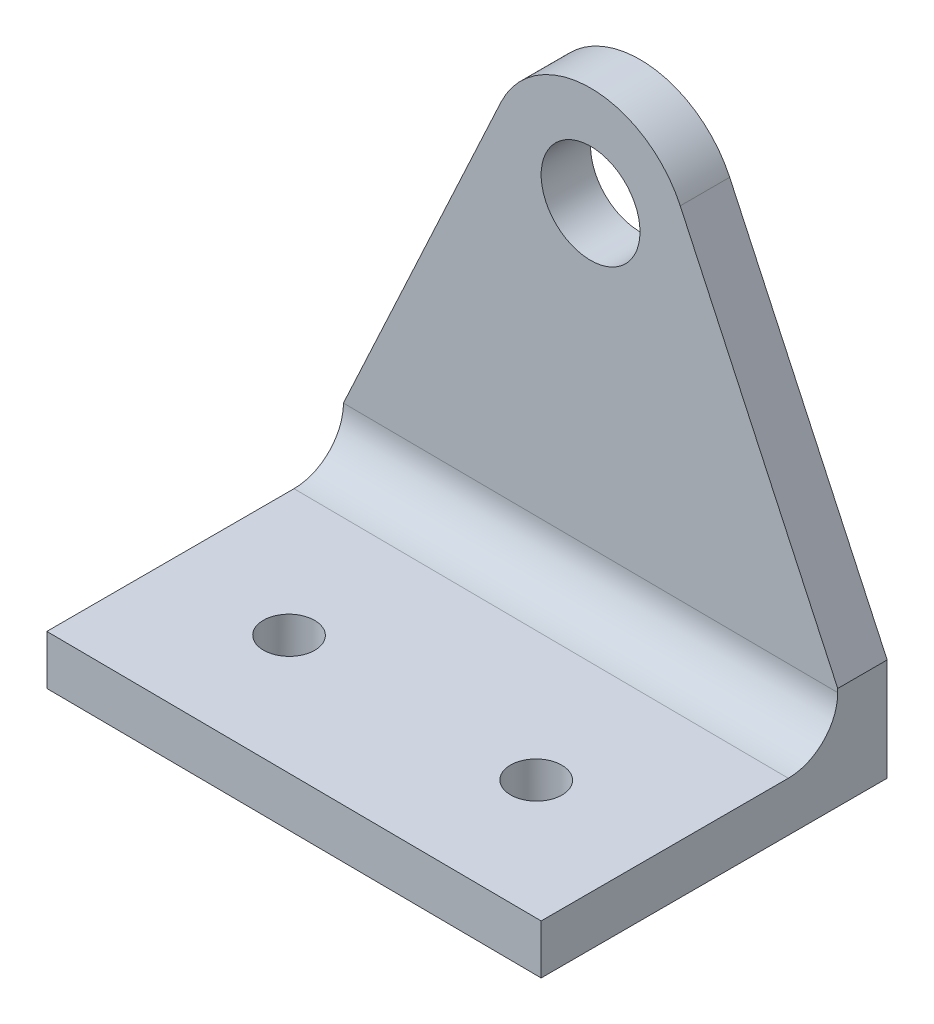
from build123d import *

# Parameters (mm, degrees)
SKETCH1_R           = 5
BOSS_EXTRUDE1_DEPTH = 5
BOSS_EXTRUDE2_DEPTH = 30
FILLET1_R           = 5
SKETCH7_R           = 2.6
CUT_EXTRUDE1_DEPTH  = 30


with BuildPart() as part:
    # Sketch1 → Boss-Extrude1 (new body)
    with BuildSketch(Plane.XY):
        with BuildLine():
            Line((-9.070221734, 4.313108884), (-25, -30))
            Line((-25, -30), (-25, -40))
            Line((-25, -40), (25, -40.363582182))
            Line((25, -40.363582182), (25, -30))
            Line((25, -30), (9.070221734, 4.313108884))
            ThreePointArc((9.070221734, 4.313108884), (0, 10.102280261), (-9.070221734, 4.313108884))
        make_face()
        Circle(SKETCH1_R, mode=Mode.SUBTRACT)
    extrude(amount=BOSS_EXTRUDE1_DEPTH)

    # Sketch6 → Boss-Extrude2 (add)
    with BuildSketch(Plane.XY.offset(5)):
        Polygon((-25, -35), (-25, -40), (25, -40.363582182), (25, -35.363582182), align=None)
    extrude(amount=BOSS_EXTRUDE2_DEPTH)

    # Fillet1
    fillet1_edges = [part.edges().sort_by_distance(p)[0] for p in [
        (0, -35.181791091, 5),
    ]]
    fillet(fillet1_edges, radius=FILLET1_R)

    # Sketch7 → Cut-Extrude1 (cut)
    with BuildSketch(Plane(origin=(-0.255815921, -35.179930889, 0), x_dir=(0.9999735626477819, -0.0072714514027518145, 0), z_dir=(0.007271451402751815, 0.999973562647782, 0))):
        with Locations(Location((-12.244838267, -23, 0), (0, 0, 180))):
            Circle(SKETCH7_R)
    cut_extrude1 = extrude(amount=-CUT_EXTRUDE1_DEPTH, mode=Mode.SUBTRACT)

    # Mirror2: Cut-Extrude1 across plane
    add(cut_extrude1.mirror(Plane(origin=(0, 0, 0), x_dir=(0, 0, 1), z_dir=(1, 0, 0))), mode=Mode.SUBTRACT)


solid = part.part
